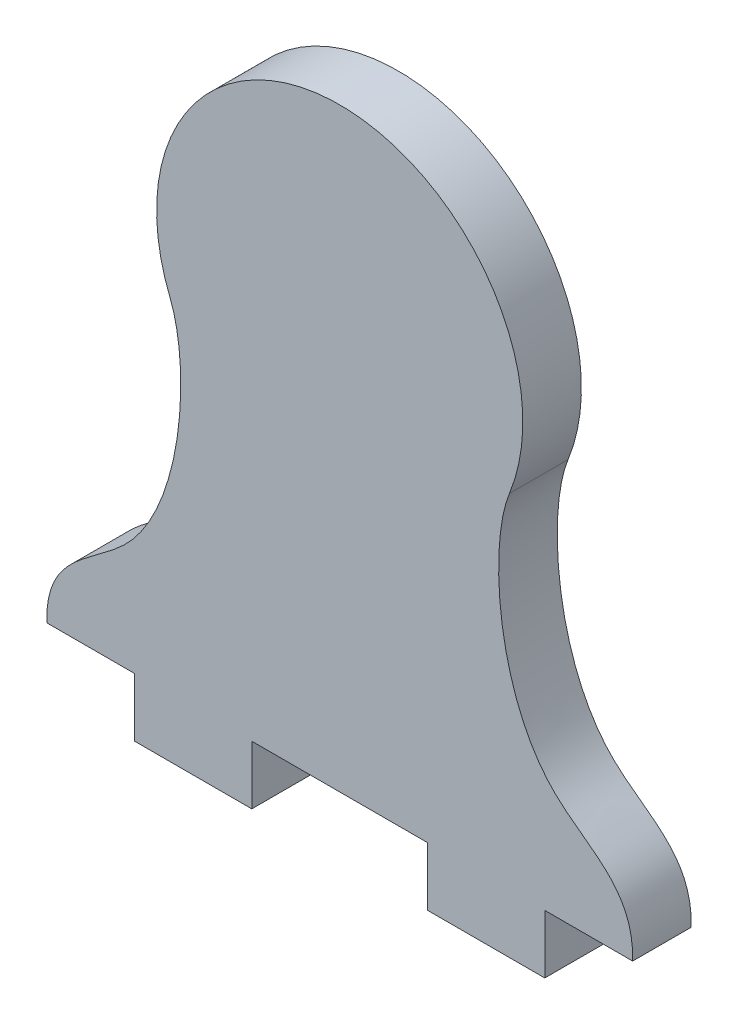
from build123d import *

# Parameters (mm, degrees)
BOSS_EXTRUDE1_DEPTH = 4


with BuildPart() as part:
    # Sketch1 → Boss-Extrude1 (new body)
    with BuildSketch(Plane.XY):
        with BuildLine():
            Line((-6, 0), (0, 0))
            Line((0, 0), (0, 40.631746277))
            ThreePointArc((0, 40.631746277), (-10.364472675, 35.119428737), (-11.587783027, 23.444179263))
            ThreePointArc((-11.587783027, 23.444179263), (-11.580453389, 23.426100806), (-11.573095546, 23.40803381))
            add(Edge.make_bspline(
                [(-20, 0), (-20.119909127, 4.314498585), (-10.868715854, 6.603153145), (-10.177575907, 19.938030034), (-11.573095546, 23.40803381)],
                knots=[0, 0, 0, 0, 0.217805144, 0.603787586, 0.603787586, 0.603787586, 0.603787586], degree=3))
            Line((-20, 0), (-14, 0))
            Line((-14, 0), (-14, -4))
            Line((-14, -4), (-6, -4))
            Line((-6, -4), (-6, 0))
        make_face()
        with BuildLine():
            Line((0, 40.631746277), (0, 0))
            Line((0, 0), (6, 0))
            Line((6, 0), (6, -4))
            Line((6, -4), (14, -4))
            Line((14, -4), (14, 0))
            Line((14, 0), (20, 0))
            add(Edge.make_bspline(
                [(20, 0), (20.119909127, 4.314498585), (10.868715854, 6.603153145), (10.177575907, 19.938030034), (11.573095546, 23.40803381)],
                knots=[0, 0, 0, 0, 0.217805144, 0.603787586, 0.603787586, 0.603787586, 0.603787586], degree=3))
            ThreePointArc((11.573095546, 23.40803381), (11.580453389, 23.426100806), (11.587783027, 23.444179263))
            ThreePointArc((11.587783027, 23.444179263), (10.364472675, 35.119428737), (0, 40.631746277))
        make_face()
    extrude(amount=BOSS_EXTRUDE1_DEPTH)


solid = part.part
